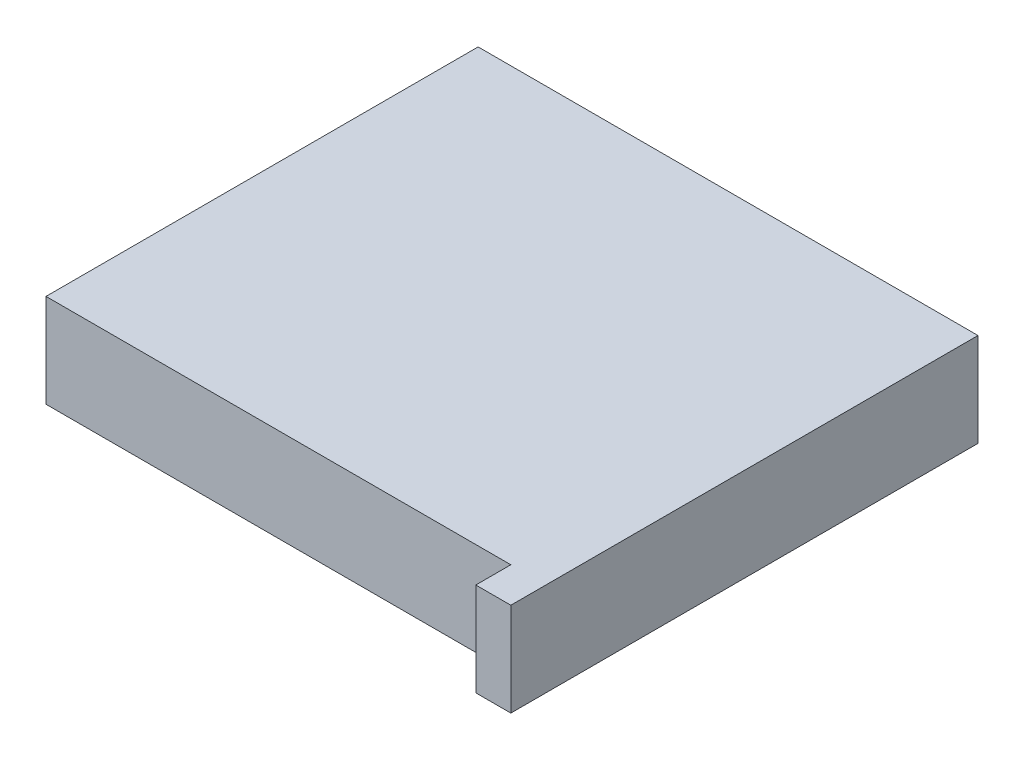
from build123d import *

# Parameters (mm, degrees)
BOSS_EXTRUDE1_DEPTH = 8


with BuildPart() as part:
    # Sketch1 → Boss-Extrude1 (new body)
    with BuildSketch(Plane(origin=(0, 0, 0), x_dir=(1, 0, 0), z_dir=(0, 1, 0))):
        Polygon((0, 0), (39.8, 0), (39.8, -3), (42.8, -3), (42.8, 0), (42.8, 37), (0, 37), align=None)
    extrude(amount=BOSS_EXTRUDE1_DEPTH)


solid = part.part
